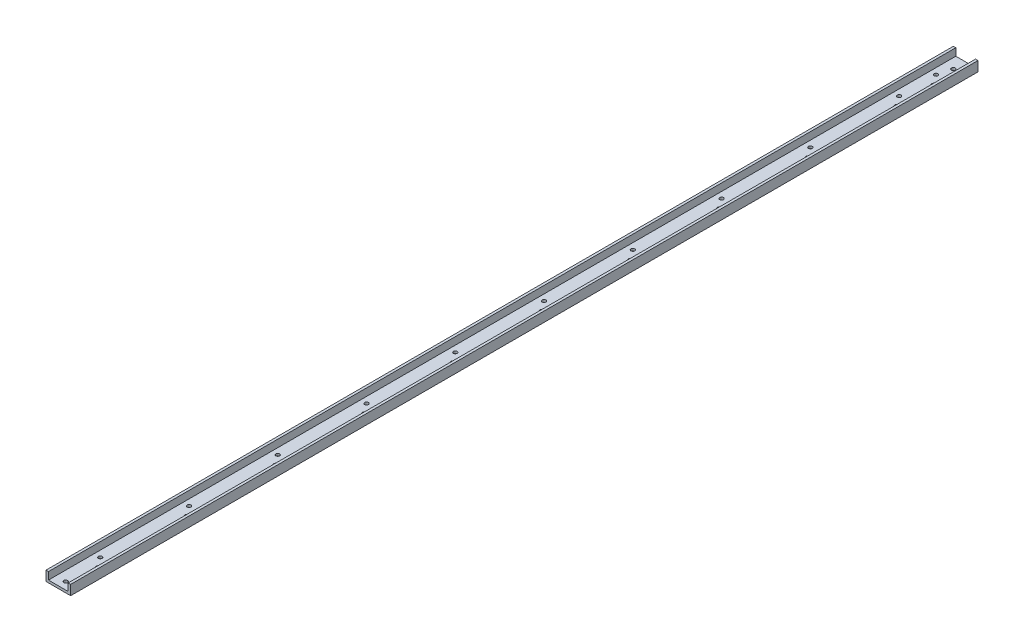
from build123d import *

# Parameters (mm, degrees)
BOSS_EXTRUDE1_DEPTH = 1168.4
CUT_EXTRUDE1_REACH  = 1170.87
SKETCH3_R           = 2.413
CUT_EXTRUDE2_REACH  = 1170.87
SKETCH4_R           = 2.413
LPATTERN1_COUNT     = 10
LPATTERN1_PITCH     = 114.3
SKETCH5_R           = 2.413
CUT_EXTRUDE3_DEPTH  = 1169.87011602
CUT_EXTRUDE4_REACH  = 1170.87
SKETCH6_R           = 2.413


with BuildPart() as part:
    # Sketch1 → Boss-Extrude1 (new body)
    with BuildSketch(Plane.XY):
        Polygon((3.175, 3.175), (3.175, 12.7), (0, 12.7), (0, 0), (31.75, 0), (31.75, 12.7), (28.575, 12.7), (28.575, 3.175), align=None)
    extrude(amount=BOSS_EXTRUDE1_DEPTH)

    # Sketch3 → Cut-Extrude1 (cut, up to next)
    with BuildSketch(Plane(origin=(0, 3.175, 0), x_dir=(1, 0, 0), z_dir=(0, 1, 0)), mode=Mode.PRIVATE) as cut_extrude1_sk1:
        with Locations(Location((11.1125, -1109.6625, 0), (0, 0, 270))):
            Circle(SKETCH3_R)
    cut_extrude1_tool1 = extrude(cut_extrude1_sk1.sketch, amount=-CUT_EXTRUDE1_REACH, mode=Mode.PRIVATE) & part.part
    # Sketch3 → Cut-Extrude1 (cut, up to next)
    with BuildSketch(Plane(origin=(0, 3.175, 0), x_dir=(1, 0, 0), z_dir=(0, 1, 0)), mode=Mode.PRIVATE) as cut_extrude1_sk2:
        with Locations(Location((20.6375, -1122.3625, 0), (0, 0, 270))):
            Circle(SKETCH3_R)
    cut_extrude1_tool2 = extrude(cut_extrude1_sk2.sketch, amount=-CUT_EXTRUDE1_REACH, mode=Mode.PRIVATE) & part.part
    cut_extrude1_1 = cut_extrude1_tool1.solids().sort_by_distance((11.1125, 3.175, 1109.6625))[0]
    add(cut_extrude1_1, mode=Mode.SUBTRACT)
    cut_extrude1_2 = cut_extrude1_tool2.solids().sort_by_distance((20.6375, 3.175, 1122.3625))[0]
    add(cut_extrude1_2, mode=Mode.SUBTRACT)
    cut_extrude1 = cut_extrude1_1 + cut_extrude1_2  # Cut-Extrude1 as one shape, for the pattern or mirror that repeats it

    # Sketch4 → Cut-Extrude2 (cut, up to next)
    with BuildSketch(Plane(origin=(0, 3.175, 0), x_dir=(1, 0, 0), z_dir=(0, 1, 0)), mode=Mode.PRIVATE) as cut_extrude2_sk1:
        with Locations(Location((15.875, -1158.875, 0), (0, 0, 270))):
            Circle(SKETCH4_R)
    cut_extrude2_tool1 = extrude(cut_extrude2_sk1.sketch, amount=-CUT_EXTRUDE2_REACH, mode=Mode.PRIVATE) & part.part
    add(cut_extrude2_tool1.solids().sort_by_distance((15.875, 3.175, 1158.875))[0], mode=Mode.SUBTRACT)

    # LPattern1: Cut-Extrude1 ×10
    with Locations(*[(0, 0, -i * LPATTERN1_PITCH) for i in range(1, LPATTERN1_COUNT)]):
        add(cut_extrude1, mode=Mode.SUBTRACT)

    # Sketch5 → Cut-Extrude3 (cut, through all)
    with BuildSketch(Plane(origin=(0, 3.175, 0), x_dir=(1, 0, 0), z_dir=(0, 1, 0))):
        with Locations(Location((20.6375, -46.0375, 0), (0, 0, 270))):
            Circle(SKETCH5_R)
        with Locations(Location((11.1125, -33.3375, 0), (0, 0, 270))):
            Circle(SKETCH5_R)
        with Locations((-236.5375, -33.3375)):
            Circle(SKETCH5_R)
        with Locations((-227.0125, -46.0375)):
            Circle(SKETCH5_R)
    extrude(amount=-CUT_EXTRUDE3_DEPTH, mode=Mode.SUBTRACT)

    # Sketch6 → Cut-Extrude4 (cut, up to next)
    with BuildSketch(Plane(origin=(0, 3.175, 0), x_dir=(1, 0, 0), z_dir=(0, 1, 0)), mode=Mode.PRIVATE) as cut_extrude4_sk1:
        with Locations(Location((15.875, -15.875, 0), (0, 0, 270))):
            Circle(SKETCH6_R)
    cut_extrude4_tool1 = extrude(cut_extrude4_sk1.sketch, amount=-CUT_EXTRUDE4_REACH, mode=Mode.PRIVATE) & part.part
    add(cut_extrude4_tool1.solids().sort_by_distance((15.875, 3.175, 15.875))[0], mode=Mode.SUBTRACT)


solid = part.part
